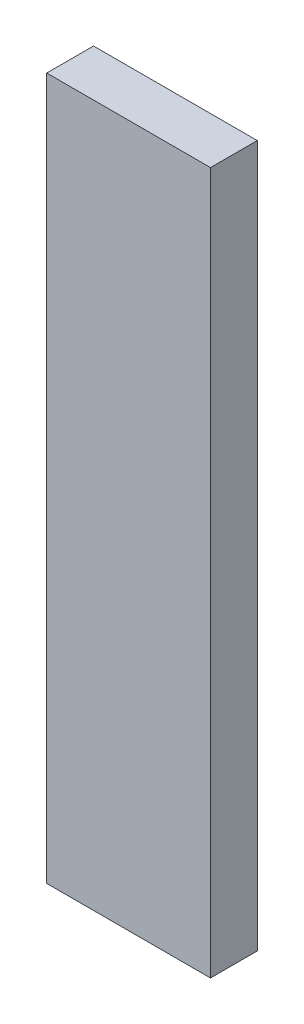
from build123d import *

# Parameters (mm, degrees)
SKETCH1_W           = 10.5
SKETCH1_H           = 45
BOSS_EXTRUDE1_DEPTH = 3


with BuildPart() as part:
    # Sketch1 → Boss-Extrude1 (new body)
    with BuildSketch(Plane.XY):
        Rectangle(SKETCH1_W, SKETCH1_H)
    extrude(amount=-BOSS_EXTRUDE1_DEPTH)


solid = part.part
